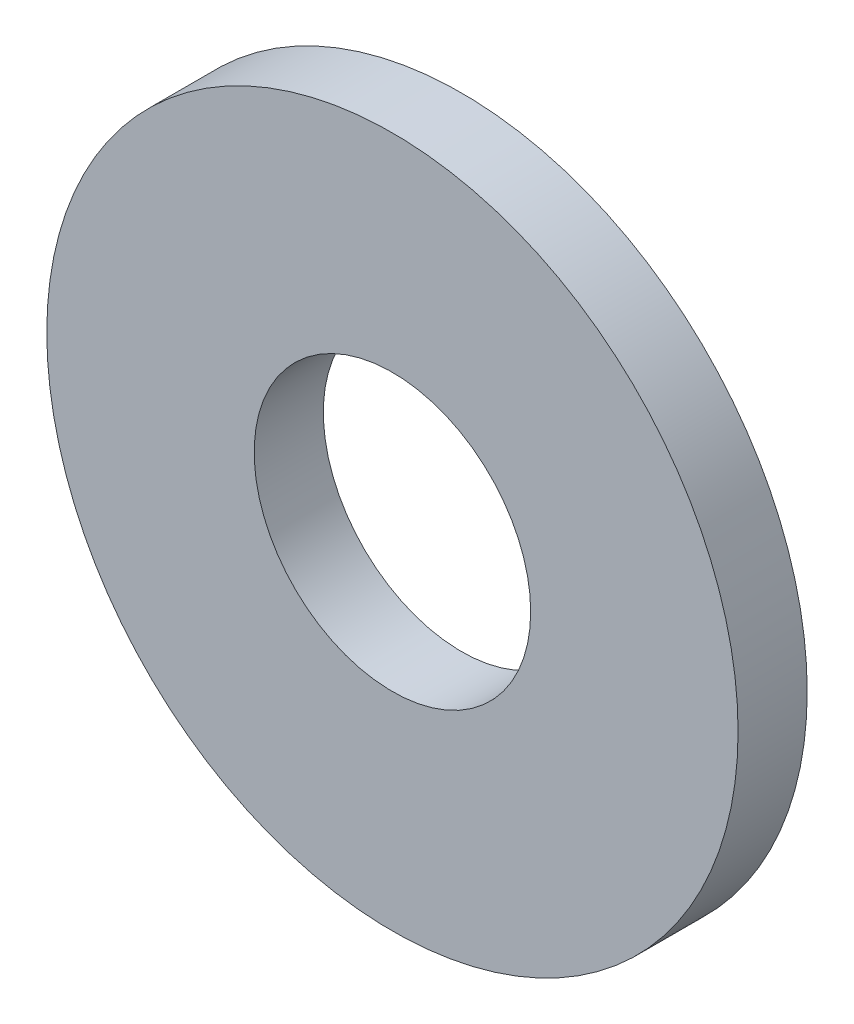
from build123d import *

# Parameters (mm, degrees)
SKETCH3_R           = 4
SKETCH3_R_2         = 1.6
BOSS_EXTRUDE1_DEPTH = 0.4


with BuildPart() as part:
    # Sketch3 → Boss-Extrude1 (new, symmetric)
    with BuildSketch(Plane.XY):
        Circle(SKETCH3_R)
        Circle(SKETCH3_R_2, mode=Mode.SUBTRACT)
    extrude(amount=BOSS_EXTRUDE1_DEPTH, both=True)


solid = part.part
